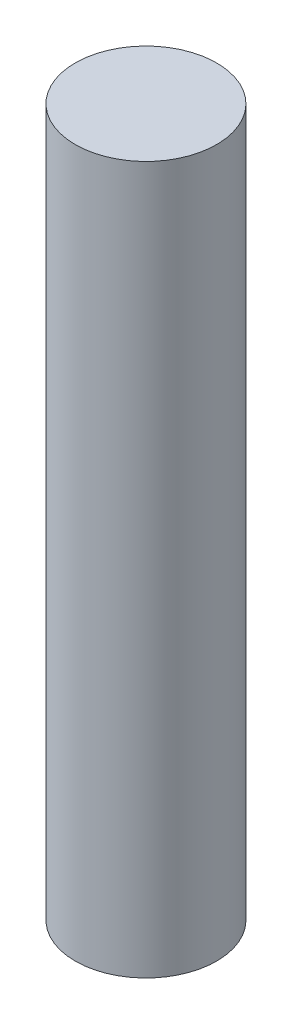
from build123d import *

# Parameters (mm, degrees)
ESQUISSE1_R        = 20
BOSS_EXTRU_1_DEPTH = 200


with BuildPart() as part:
    # Esquisse1 → Boss.-Extru.1 (new body)
    with BuildSketch(Plane(origin=(0, 0, 0), x_dir=(1, 0, 0), z_dir=(0, 1, 0))):
        with Locations(Location((0, 0, 0), (0, 0, 270))):
            Circle(ESQUISSE1_R)
    extrude(amount=BOSS_EXTRU_1_DEPTH)


solid = part.part
